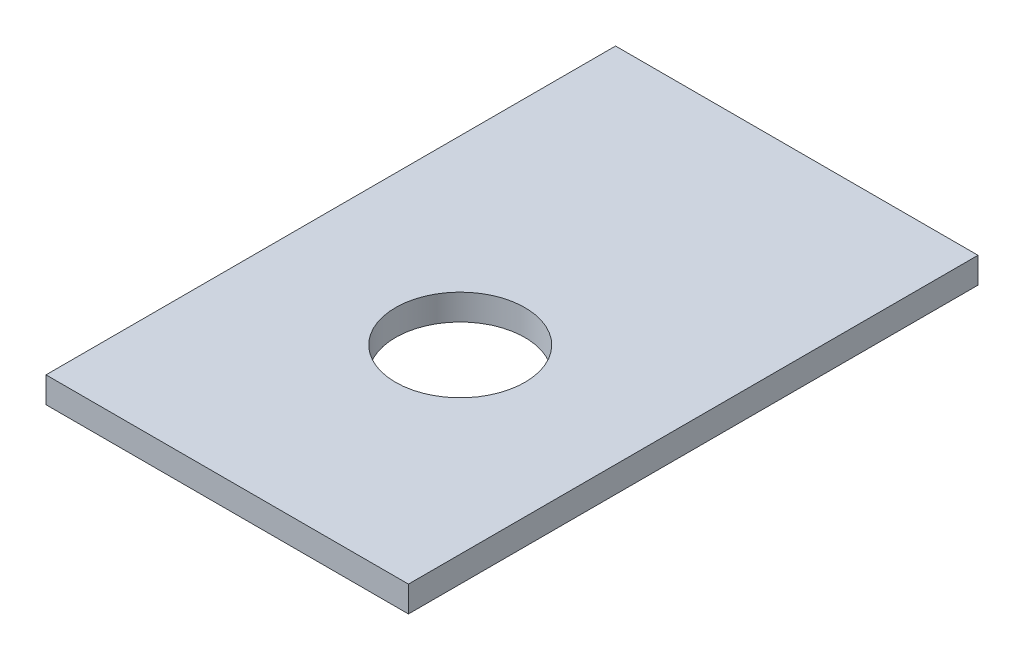
from build123d import *

# Parameters (mm, degrees)
CROQUIS1_W              = 70
CROQUIS1_H              = 110
CROQUIS1_R              = 12.5
SALIENTE_EXTRUIR1_DEPTH = 5


with BuildPart() as part:
    # Croquis1 → Saliente-Extruir1 (new body)
    with BuildSketch(Plane(origin=(0, 0, 0), x_dir=(1, 0, 0), z_dir=(0, 1, 0))):
        with Locations((5.796178344, -36.162420382)):
            Rectangle(CROQUIS1_W, CROQUIS1_H)
        with Locations(Location((5.796178344, -46.162420382, 0), (0, 0, 270))):
            Circle(CROQUIS1_R, mode=Mode.SUBTRACT)
    extrude(amount=SALIENTE_EXTRUIR1_DEPTH)


solid = part.part
